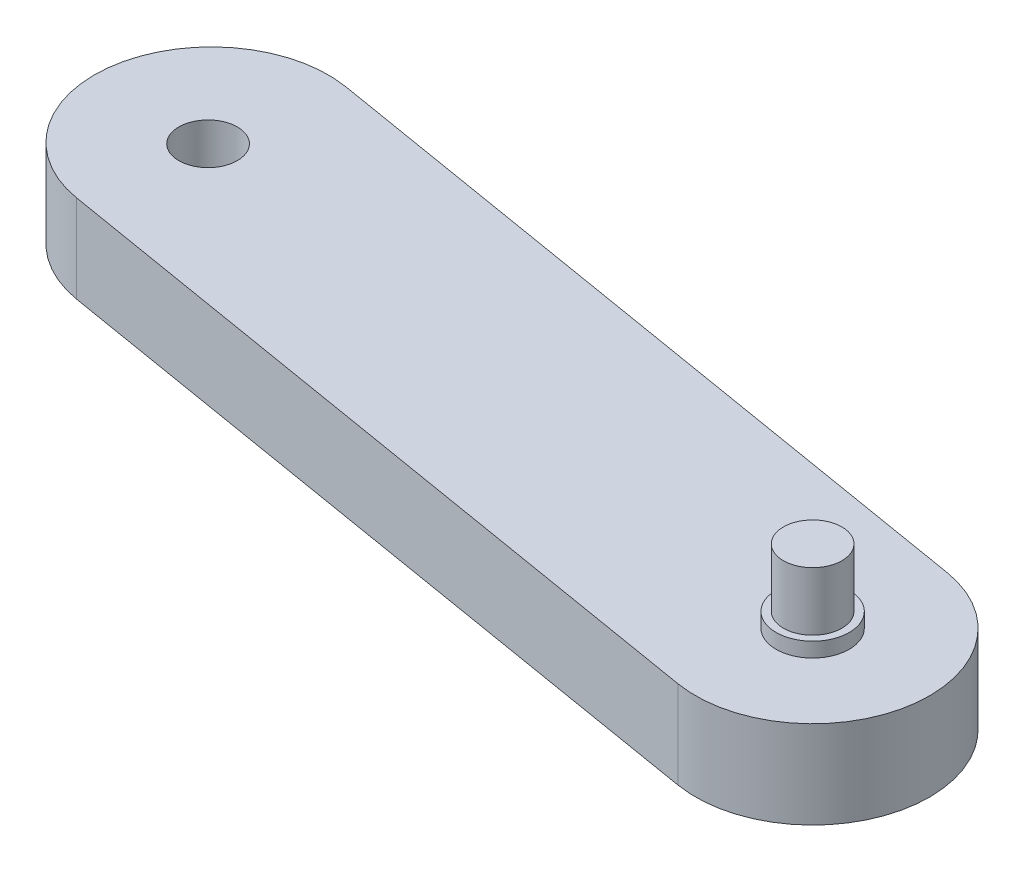
from build123d import *

# Parameters (mm, degrees)
BOSS_EXTRUDE1_DEPTH   = 6
SKETCH4_R             = 2.5
BOSS_EXTRUDE3_DEPTH   = 5
BODY_MOVE_COPY1_ANGLE = 90
CUT_EXTRUDE4_START    = -4
SKETCH8_R             = 2.5
SKETCH8_R_2           = 2
CUT_EXTRUDE4_DEPTH    = 4
BODY_MOVE_COPY2_ANGLE = 180
BODY_MOVE_COPY3_ANGLE = 35
BODY_MOVE_COPY4_ANGLE = 180
SKETCH9_R             = 2
CUT_EXTRUDE5_DEPTH    = 10
BODY_MOVE_COPY5_ANGLE = 180


with BuildPart() as part:
    # Sketch1 → Boss-Extrude1 (new body)
    with BuildSketch(Plane.XY):
        with BuildLine():
            Line((0, 8), (50, 8))
            ThreePointArc((50, 8), (58, 0), (50, -8))
            Line((50, -8), (0, -8))
            ThreePointArc((0, -8), (-8, 0), (0, 8))
        make_face()
    extrude(amount=BOSS_EXTRUDE1_DEPTH)

    # Sketch4 → Boss-Extrude3 (add)
    with BuildSketch(Plane(origin=(0, 0, 0), x_dir=(-1, 0, 0), z_dir=(0, 0, -1))):
        with Locations(Location((-50, 0, 0), (0, 0, 180))):
            Circle(SKETCH4_R)
    extrude(amount=BOSS_EXTRUDE3_DEPTH)


with BuildPart() as part_1:
    # Body-Move/Copy1: moved
    add(part.part.rotate(Axis((0, 0, 11), (-1, 0, 0)), BODY_MOVE_COPY1_ANGLE))

    # Sketch8 → Cut-Extrude4 (cut)
    with BuildSketch(Plane.XZ.offset(16).offset(CUT_EXTRUDE4_START)):
        with Locations((50, 11)):
            Circle(SKETCH8_R)
        with Locations(Location((50, 11, 0), (0, 0, 270))):
            Circle(SKETCH8_R_2, mode=Mode.SUBTRACT)
    extrude(amount=CUT_EXTRUDE4_DEPTH, mode=Mode.SUBTRACT)


with BuildPart() as part_2:
    # Body-Move/Copy2: moved
    add(part_1.part.moved(Location((0, 0, 0))).rotate(Axis((-0.872729887, 0, 2.730506299), (0.9525286063620858, -4.30488929887132e-15, 0.3044490992956008)), BODY_MOVE_COPY2_ANGLE))


with BuildPart() as part_3:
    # Body-Move/Copy3: moved
    add(part_2.part.rotate(Axis((25, 0, 11), (0, 1, 0)), BODY_MOVE_COPY3_ANGLE))


with BuildPart() as part_4:
    # Body-Move/Copy4: moved
    add(part_3.part.rotate(Axis((0, 0, 11), (1, 0, 0)), BODY_MOVE_COPY4_ANGLE))

    # Sketch9 → Cut-Extrude5 (cut)
    with BuildSketch(Plane.XZ.offset(11)):
        with Locations(Location((0, 11, 0), (0, 0, 270))):
            Circle(SKETCH9_R)
    extrude(amount=-CUT_EXTRUDE5_DEPTH, mode=Mode.SUBTRACT)


with BuildPart() as part_5:
    # Body-Move/Copy5: moved
    add(part_4.part.moved(Location((0, 0, 0))).rotate(Axis((-0.706607659, -10.5, 8.976422606), (0.9969160490117142, -5.357682201744958e-14, 0.07847541795284477)), BODY_MOVE_COPY5_ANGLE))


solid = part_5.part
